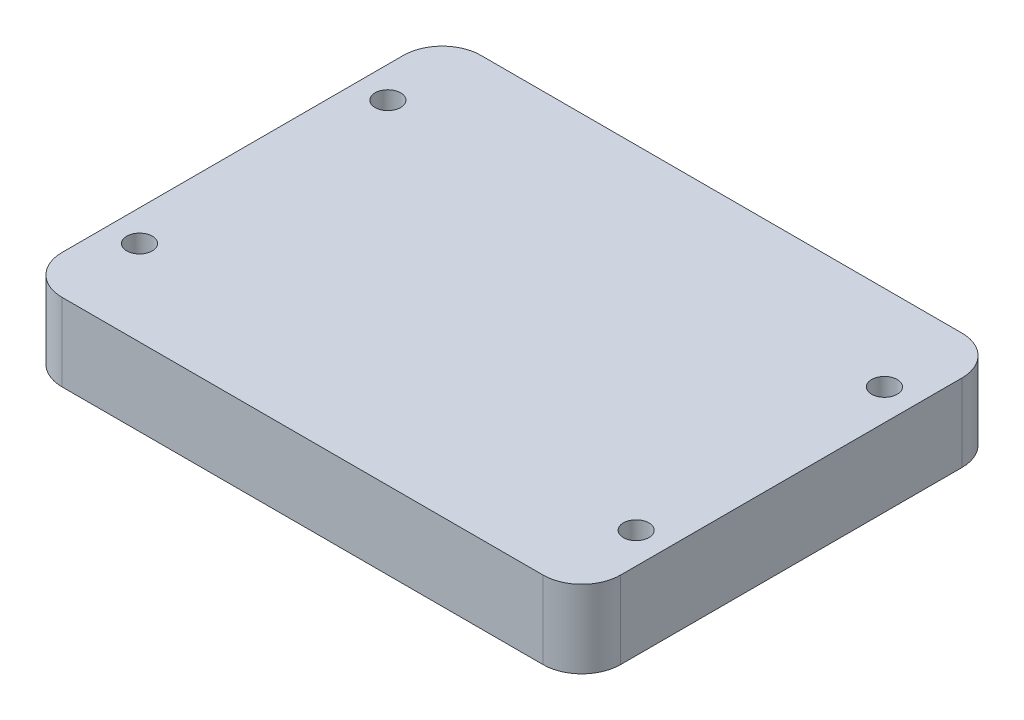
from build123d import *

# Parameters (mm, degrees)
SKETCH_1_W               = 72
SKETCH_1_H               = 54
EXTRUDE_1_DEPTH          = 10
CUT_EXTRUDE_1_DEPTH      = 47.097722286
CUT_EXTRUDE_1_DEPTH_BACK = 47.097722286
SKETCH_2_R               = 1.65
FILLET_1_R               = 5


with BuildPart() as part:
    # 草图1 → 凸台-拉伸1 (new body)
    with BuildSketch(Plane(origin=(0, 0, 0), x_dir=(1, 0, 0), z_dir=(0, 1, 0))):
        Rectangle(SKETCH_1_W, SKETCH_1_H)
    extrude(amount=EXTRUDE_1_DEPTH)

    # 草图2 → 切除-拉伸1 (cut, two sides: drawn at the far end of the back side and taken through both)
    with BuildSketch(Plane(origin=(0, 10, 0), x_dir=(1, 0, 0), z_dir=(0, 1, 0)).offset(-CUT_EXTRUDE_1_DEPTH_BACK)):
        with Locations(Location((-32, 16, 0), (0, 0, 270))):
            Circle(SKETCH_2_R)
        with Locations(Location((32, 16, 0), (0, 0, 270))):
            Circle(SKETCH_2_R)
        with Locations(Location((32, -16, 0), (0, 0, 270))):
            Circle(SKETCH_2_R)
        with Locations(Location((-32, -16, 0), (0, 0, 270))):
            Circle(SKETCH_2_R)
    extrude(amount=CUT_EXTRUDE_1_DEPTH + CUT_EXTRUDE_1_DEPTH_BACK, mode=Mode.SUBTRACT)

    # 圆角1
    fillet_1_edges = [part.edges().sort_by_distance(p)[0] for p in [
        (36, 5, 27),
        (-36, 5, 27),
        (-36, 5, -27),
        (36, 5, -27),
    ]]
    fillet(fillet_1_edges, radius=FILLET_1_R)


solid = part.part
